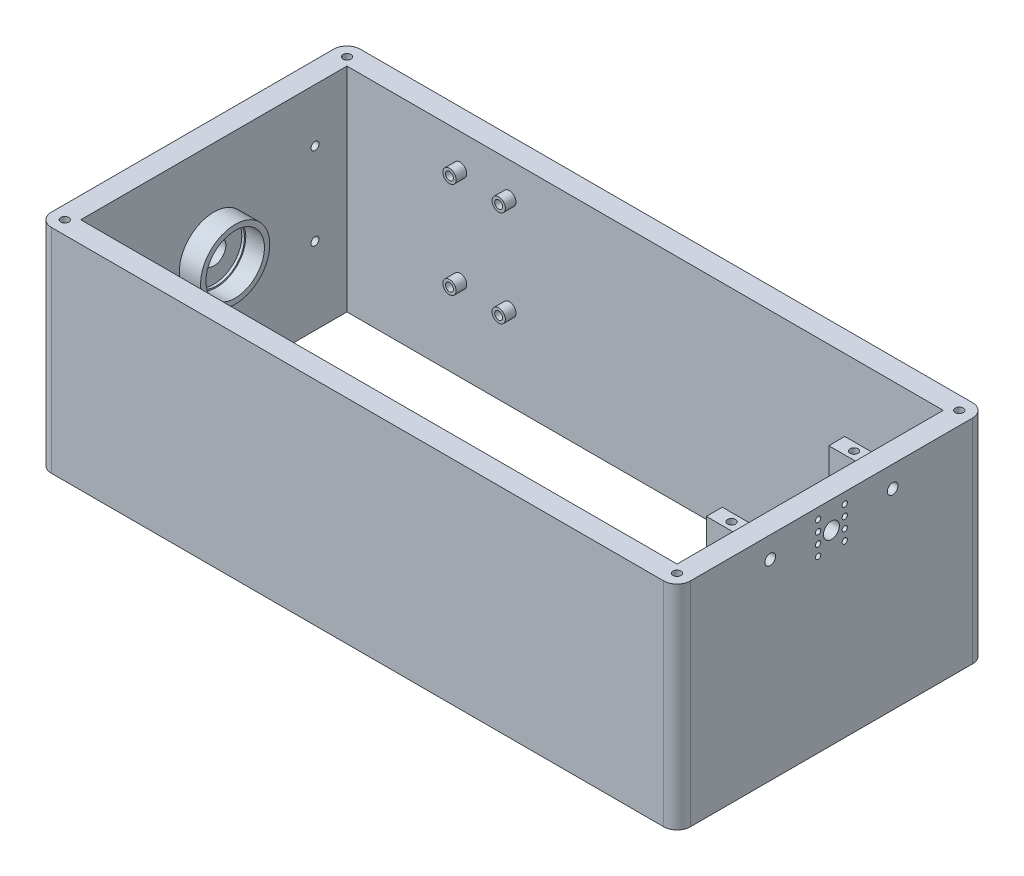
from build123d import *

# Parameters (mm, degrees)
SKETCH1_W           = 240
SKETCH1_H           = 116
BOSS_EXTRUDE1_DEPTH = 10
SKETCH10_W          = 240
SKETCH10_H          = 116
SKETCH10_W_2        = 224
SKETCH10_H_2        = 100
BOSS_EXTRUDE4_DEPTH = 80
CUT_EXTRUDE14_REACH = 257.515
SKETCH24_R          = 1.5
SKETCH14_R          = 13
SKETCH14_R_2        = 11
BOSS_EXTRUDE6_DEPTH = 8
SKETCH16_R          = 11
SKETCH16_R_2        = 10.5
BOSS_EXTRUDE7_DEPTH = 1
CUT_EXTRUDE9_REACH  = 257.515
SKETCH17_R          = 4.5
SKETCH18_R          = 2.5
SKETCH18_R_2        = 1.5
BOSS_EXTRUDE8_DEPTH = 4
FILLET1_R           = 5
CUT_EXTRUDE10_REACH = 162.823
SKETCH19_R          = 1.5
CUT_EXTRUDE11_REACH = 264.8
SKETCH20_R          = 2
SKETCH21_W          = 6
SKETCH21_H          = 10
SKETCH21_R          = 2
BOSS_EXTRUDE9_DEPTH = 13
CUT_EXTRUDE12_REACH = 161.163
SKETCH22_R          = 1.5
CUT_EXTRUDE13_REACH = 264.8
SKETCH23_R          = 1
SKETCH23_R_2        = 3
CUT_EXTRUDE15_REACH = 264.8
SKETCH32_W          = 116
SKETCH32_H          = 10


with BuildPart() as part:
    # Sketch1 → Boss-Extrude1 (new body)
    with BuildSketch(Plane(origin=(0, 0, 0), x_dir=(1, 0, 0), z_dir=(0, 1, 0))):
        Rectangle(SKETCH1_W, SKETCH1_H)
    extrude(amount=BOSS_EXTRUDE1_DEPTH)

    # Sketch10 → Boss-Extrude4 (add)
    with BuildSketch(Plane(origin=(0, 10, 0), x_dir=(1, 0, 0), z_dir=(0, 1, 0))):
        Rectangle(SKETCH10_W, SKETCH10_H)
        Rectangle(SKETCH10_W_2, SKETCH10_H_2, mode=Mode.SUBTRACT)
    extrude(amount=BOSS_EXTRUDE4_DEPTH)

    # Sketch24 → Cut-Extrude14 (cut, up to next)
    with BuildSketch(Plane(origin=(-112, 0, 0), x_dir=(0, 0, -1), z_dir=(1, 0, 0)), mode=Mode.PRIVATE) as cut_extrude14_sk1:
        with Locations((-38, 70)):
            Circle(SKETCH24_R)
    cut_extrude14_tool1 = extrude(cut_extrude14_sk1.sketch, amount=-CUT_EXTRUDE14_REACH, mode=Mode.PRIVATE) & part.part
    # Sketch24 → Cut-Extrude14 (cut, up to next)
    with BuildSketch(Plane(origin=(-112, 0, 0), x_dir=(0, 0, -1), z_dir=(1, 0, 0)), mode=Mode.PRIVATE) as cut_extrude14_sk2:
        with Locations((-38, 39)):
            Circle(SKETCH24_R)
    cut_extrude14_tool2 = extrude(cut_extrude14_sk2.sketch, amount=-CUT_EXTRUDE14_REACH, mode=Mode.PRIVATE) & part.part
    # Sketch24 → Cut-Extrude14 (cut, up to next)
    with BuildSketch(Plane(origin=(-112, 0, 0), x_dir=(0, 0, -1), z_dir=(1, 0, 0)), mode=Mode.PRIVATE) as cut_extrude14_sk3:
        with Locations((38, 39)):
            Circle(SKETCH24_R)
    cut_extrude14_tool3 = extrude(cut_extrude14_sk3.sketch, amount=-CUT_EXTRUDE14_REACH, mode=Mode.PRIVATE) & part.part
    # Sketch24 → Cut-Extrude14 (cut, up to next)
    with BuildSketch(Plane(origin=(-112, 0, 0), x_dir=(0, 0, -1), z_dir=(1, 0, 0)), mode=Mode.PRIVATE) as cut_extrude14_sk4:
        with Locations((38, 70)):
            Circle(SKETCH24_R)
    cut_extrude14_tool4 = extrude(cut_extrude14_sk4.sketch, amount=-CUT_EXTRUDE14_REACH, mode=Mode.PRIVATE) & part.part
    add(cut_extrude14_tool1.solids().sort_by_distance((-112, 70, 38))[0], mode=Mode.SUBTRACT)
    add(cut_extrude14_tool2.solids().sort_by_distance((-112, 39, 38))[0], mode=Mode.SUBTRACT)
    add(cut_extrude14_tool3.solids().sort_by_distance((-112, 39, -38))[0], mode=Mode.SUBTRACT)
    add(cut_extrude14_tool4.solids().sort_by_distance((-112, 70, -38))[0], mode=Mode.SUBTRACT)

    # Sketch14 → Boss-Extrude6 (add)
    with BuildSketch(Plane(origin=(-112, 0, 0), x_dir=(0, 0, -1), z_dir=(1, 0, 0))):
        with Locations((0, 54.5)):
            Circle(SKETCH14_R)
        with Locations((0, 54.5)):
            Circle(SKETCH14_R_2, mode=Mode.SUBTRACT)
    extrude(amount=BOSS_EXTRUDE6_DEPTH)

    # Sketch16 → Boss-Extrude7 (add)
    with BuildSketch(Plane(origin=(-112, 0, 0), x_dir=(0, 0, -1), z_dir=(1, 0, 0))):
        with Locations((0, 54.5)):
            Circle(SKETCH16_R)
        with Locations((0, 54.5)):
            Circle(SKETCH16_R_2, mode=Mode.SUBTRACT)
    extrude(amount=BOSS_EXTRUDE7_DEPTH)

    # Sketch17 → Cut-Extrude9 (cut, up to next)
    with BuildSketch(Plane(origin=(-112, 0, 0), x_dir=(0, 0, -1), z_dir=(1, 0, 0)), mode=Mode.PRIVATE) as cut_extrude9_sk1:
        with Locations((0, 54.5)):
            Circle(SKETCH17_R)
    cut_extrude9_tool1 = extrude(cut_extrude9_sk1.sketch, amount=-CUT_EXTRUDE9_REACH, mode=Mode.PRIVATE) & part.part
    add(cut_extrude9_tool1.solids().sort_by_distance((-112, 54.5, 0))[0], mode=Mode.SUBTRACT)

    # Sketch18 → Boss-Extrude8 (add)
    # profile 1 of 4: a face of its own
    with BuildSketch(Plane.XY.offset(-50)):
        with Locations((-69.5, 77.5)):
            Circle(SKETCH18_R)
        with Locations((-69.5, 77.5)):
            Circle(SKETCH18_R_2, mode=Mode.SUBTRACT)
    # profile 2 of 4: a face of its own
    with BuildSketch(Plane.XY.offset(-50)):
        with Locations(Location((-69.5, 41.351210886, 0), (0, 0, 180))):
            Circle(SKETCH18_R)
        with Locations(Location((-69.5, 41.351210886, 0), (0, 0, 180))):
            Circle(SKETCH18_R_2, mode=Mode.SUBTRACT)
    # profile 3 of 4: a face of its own
    with BuildSketch(Plane.XY.offset(-50)):
        with Locations((-51, 41.351210886)):
            Circle(SKETCH18_R)
        with Locations((-51, 41.351210886)):
            Circle(SKETCH18_R_2, mode=Mode.SUBTRACT)
    # profile 4 of 4: a face of its own
    with BuildSketch(Plane.XY.offset(-50)):
        with Locations(Location((-51, 77.5, 0), (0, 0, 180))):
            Circle(SKETCH18_R)
        with Locations(Location((-51, 77.5, 0), (0, 0, 180))):
            Circle(SKETCH18_R_2, mode=Mode.SUBTRACT)
    extrude(amount=BOSS_EXTRUDE8_DEPTH)

    # Fillet1
    fillet1_edges = [part.edges().sort_by_distance(p)[0] for p in [
        (0, 0, 58),
        (-120, 0, 0),
        (0, 0, -58),
        (120, 0, 0),
        (120, 45, 58),
        (-120, 45, 58),
        (-120, 45, -58),
        (120, 45, -58),
    ]]
    fillet(fillet1_edges, radius=FILLET1_R)

    # Sketch19 → Cut-Extrude10 (cut, up to next)
    with BuildSketch(Plane(origin=(0, 90, 0), x_dir=(1, 0, 0), z_dir=(0, 1, 0)), mode=Mode.PRIVATE) as cut_extrude10_sk1:
        with Locations(Location((115, 53, 0), (0, 0, 270))):
            Circle(SKETCH19_R)
    cut_extrude10_tool1 = extrude(cut_extrude10_sk1.sketch, amount=-CUT_EXTRUDE10_REACH, mode=Mode.PRIVATE) & part.part
    # Sketch19 → Cut-Extrude10 (cut, up to next)
    with BuildSketch(Plane(origin=(0, 90, 0), x_dir=(1, 0, 0), z_dir=(0, 1, 0)), mode=Mode.PRIVATE) as cut_extrude10_sk2:
        with Locations(Location((-115, 53, 0), (0, 0, 270))):
            Circle(SKETCH19_R)
    cut_extrude10_tool2 = extrude(cut_extrude10_sk2.sketch, amount=-CUT_EXTRUDE10_REACH, mode=Mode.PRIVATE) & part.part
    # Sketch19 → Cut-Extrude10 (cut, up to next)
    with BuildSketch(Plane(origin=(0, 90, 0), x_dir=(1, 0, 0), z_dir=(0, 1, 0)), mode=Mode.PRIVATE) as cut_extrude10_sk3:
        with Locations(Location((-115, -53, 0), (0, 0, 270))):
            Circle(SKETCH19_R)
    cut_extrude10_tool3 = extrude(cut_extrude10_sk3.sketch, amount=-CUT_EXTRUDE10_REACH, mode=Mode.PRIVATE) & part.part
    # Sketch19 → Cut-Extrude10 (cut, up to next)
    with BuildSketch(Plane(origin=(0, 90, 0), x_dir=(1, 0, 0), z_dir=(0, 1, 0)), mode=Mode.PRIVATE) as cut_extrude10_sk4:
        with Locations(Location((115, -53, 0), (0, 0, 270))):
            Circle(SKETCH19_R)
    cut_extrude10_tool4 = extrude(cut_extrude10_sk4.sketch, amount=-CUT_EXTRUDE10_REACH, mode=Mode.PRIVATE) & part.part
    add(cut_extrude10_tool1.solids().sort_by_distance((115, 90, -53))[0], mode=Mode.SUBTRACT)
    add(cut_extrude10_tool2.solids().sort_by_distance((-115, 90, -53))[0], mode=Mode.SUBTRACT)
    add(cut_extrude10_tool3.solids().sort_by_distance((-115, 90, 53))[0], mode=Mode.SUBTRACT)
    add(cut_extrude10_tool4.solids().sort_by_distance((115, 90, 53))[0], mode=Mode.SUBTRACT)

    # Sketch20 → Cut-Extrude11 (cut, up to next)
    with BuildSketch(Plane(origin=(120, 0, 0), x_dir=(0, 0, -1), z_dir=(1, 0, 0)), mode=Mode.PRIVATE) as cut_extrude11_sk1:
        with Locations((-23, 82)):
            Circle(SKETCH20_R)
    cut_extrude11_tool1 = extrude(cut_extrude11_sk1.sketch, amount=-CUT_EXTRUDE11_REACH, mode=Mode.PRIVATE) & part.part
    # Sketch20 → Cut-Extrude11 (cut, up to next)
    with BuildSketch(Plane(origin=(120, 0, 0), x_dir=(0, 0, -1), z_dir=(1, 0, 0)), mode=Mode.PRIVATE) as cut_extrude11_sk2:
        with Locations(Location((23, 82, 0), (0, 0, 180))):
            Circle(SKETCH20_R)
    cut_extrude11_tool2 = extrude(cut_extrude11_sk2.sketch, amount=-CUT_EXTRUDE11_REACH, mode=Mode.PRIVATE) & part.part
    add(cut_extrude11_tool1.solids().sort_by_distance((120, 82, 23))[0], mode=Mode.SUBTRACT)
    add(cut_extrude11_tool2.solids().sort_by_distance((120, 82, -23))[0], mode=Mode.SUBTRACT)

    # Sketch21 → Boss-Extrude9 (add)
    # profile 1 of 2: a face of its own
    with BuildSketch(Plane.ZY.offset(-112)):
        with Locations((-23, 82)):
            Rectangle(SKETCH21_W, SKETCH21_H)
        with Locations((-23, 82)):
            Circle(SKETCH21_R, mode=Mode.SUBTRACT)
    # profile 2 of 2: a face of its own
    with BuildSketch(Plane.ZY.offset(-112)):
        with Locations((23, 82)):
            Rectangle(SKETCH21_W, SKETCH21_H)
        with Locations(Location((23, 82, 0), (0, 0, 180))):
            Circle(SKETCH21_R, mode=Mode.SUBTRACT)
    extrude(amount=BOSS_EXTRUDE9_DEPTH)

    # Sketch22 → Cut-Extrude12 (cut, up to next)
    with BuildSketch(Plane(origin=(0, 87, 0), x_dir=(1, 0, 0), z_dir=(0, 1, 0)), mode=Mode.PRIVATE) as cut_extrude12_sk1:
        with Locations(Location((105.5, -23, 0), (0, 0, 270))):
            Circle(SKETCH22_R)
    cut_extrude12_tool1 = extrude(cut_extrude12_sk1.sketch, amount=-CUT_EXTRUDE12_REACH, mode=Mode.PRIVATE) & part.part
    # Sketch22 → Cut-Extrude12 (cut, up to next)
    with BuildSketch(Plane(origin=(0, 87, 0), x_dir=(1, 0, 0), z_dir=(0, 1, 0)), mode=Mode.PRIVATE) as cut_extrude12_sk2:
        with Locations(Location((105.5, 23, 0), (0, 0, 270))):
            Circle(SKETCH22_R)
    cut_extrude12_tool2 = extrude(cut_extrude12_sk2.sketch, amount=-CUT_EXTRUDE12_REACH, mode=Mode.PRIVATE) & part.part
    add(cut_extrude12_tool1.solids().sort_by_distance((105.5, 87, 23))[0], mode=Mode.SUBTRACT)
    add(cut_extrude12_tool2.solids().sort_by_distance((105.5, 87, -23))[0], mode=Mode.SUBTRACT)

    # Sketch23 → Cut-Extrude13 (cut, up to next)
    with BuildSketch(Plane(origin=(120, 0, 0), x_dir=(0, 0, -1), z_dir=(1, 0, 0)), mode=Mode.PRIVATE) as cut_extrude13_sk1:
        with Locations((5, 78)):
            Circle(SKETCH23_R)
    cut_extrude13_tool1 = extrude(cut_extrude13_sk1.sketch, amount=-CUT_EXTRUDE13_REACH, mode=Mode.PRIVATE) & part.part
    # Sketch23 → Cut-Extrude13 (cut, up to next)
    with BuildSketch(Plane(origin=(120, 0, 0), x_dir=(0, 0, -1), z_dir=(1, 0, 0)), mode=Mode.PRIVATE) as cut_extrude13_sk2:
        with Locations((-5, 78)):
            Circle(SKETCH23_R)
    cut_extrude13_tool2 = extrude(cut_extrude13_sk2.sketch, amount=-CUT_EXTRUDE13_REACH, mode=Mode.PRIVATE) & part.part
    # Sketch23 → Cut-Extrude13 (cut, up to next)
    with BuildSketch(Plane(origin=(120, 0, 0), x_dir=(0, 0, -1), z_dir=(1, 0, 0)), mode=Mode.PRIVATE) as cut_extrude13_sk3:
        with Locations((5, 74)):
            Circle(SKETCH23_R)
    cut_extrude13_tool3 = extrude(cut_extrude13_sk3.sketch, amount=-CUT_EXTRUDE13_REACH, mode=Mode.PRIVATE) & part.part
    # Sketch23 → Cut-Extrude13 (cut, up to next)
    with BuildSketch(Plane(origin=(120, 0, 0), x_dir=(0, 0, -1), z_dir=(1, 0, 0)), mode=Mode.PRIVATE) as cut_extrude13_sk4:
        with Locations((-5, 74)):
            Circle(SKETCH23_R)
    cut_extrude13_tool4 = extrude(cut_extrude13_sk4.sketch, amount=-CUT_EXTRUDE13_REACH, mode=Mode.PRIVATE) & part.part
    # Sketch23 → Cut-Extrude13 (cut, up to next)
    with BuildSketch(Plane(origin=(120, 0, 0), x_dir=(0, 0, -1), z_dir=(1, 0, 0)), mode=Mode.PRIVATE) as cut_extrude13_sk5:
        with Locations(Location((-5, 86, 0), (0, 0, 180))):
            Circle(SKETCH23_R)
    cut_extrude13_tool5 = extrude(cut_extrude13_sk5.sketch, amount=-CUT_EXTRUDE13_REACH, mode=Mode.PRIVATE) & part.part
    # Sketch23 → Cut-Extrude13 (cut, up to next)
    with BuildSketch(Plane(origin=(120, 0, 0), x_dir=(0, 0, -1), z_dir=(1, 0, 0)), mode=Mode.PRIVATE) as cut_extrude13_sk6:
        with Locations(Location((5, 86, 0), (0, 0, 180))):
            Circle(SKETCH23_R)
    cut_extrude13_tool6 = extrude(cut_extrude13_sk6.sketch, amount=-CUT_EXTRUDE13_REACH, mode=Mode.PRIVATE) & part.part
    # Sketch23 → Cut-Extrude13 (cut, up to next)
    with BuildSketch(Plane(origin=(120, 0, 0), x_dir=(0, 0, -1), z_dir=(1, 0, 0)), mode=Mode.PRIVATE) as cut_extrude13_sk7:
        with Locations(Location((-5, 82, 0), (0, 0, 180))):
            Circle(SKETCH23_R)
    cut_extrude13_tool7 = extrude(cut_extrude13_sk7.sketch, amount=-CUT_EXTRUDE13_REACH, mode=Mode.PRIVATE) & part.part
    # Sketch23 → Cut-Extrude13 (cut, up to next)
    with BuildSketch(Plane(origin=(120, 0, 0), x_dir=(0, 0, -1), z_dir=(1, 0, 0)), mode=Mode.PRIVATE) as cut_extrude13_sk8:
        with Locations(Location((5, 82, 0), (0, 0, 180))):
            Circle(SKETCH23_R)
    cut_extrude13_tool8 = extrude(cut_extrude13_sk8.sketch, amount=-CUT_EXTRUDE13_REACH, mode=Mode.PRIVATE) & part.part
    # Sketch23 → Cut-Extrude13 (cut, up to next)
    with BuildSketch(Plane(origin=(120, 0, 0), x_dir=(0, 0, -1), z_dir=(1, 0, 0)), mode=Mode.PRIVATE) as cut_extrude13_sk9:
        with Locations((0, 80)):
            Circle(SKETCH23_R_2)
    cut_extrude13_tool9 = extrude(cut_extrude13_sk9.sketch, amount=-CUT_EXTRUDE13_REACH, mode=Mode.PRIVATE) & part.part
    add(cut_extrude13_tool1.solids().sort_by_distance((120, 78, -5))[0], mode=Mode.SUBTRACT)
    add(cut_extrude13_tool2.solids().sort_by_distance((120, 78, 5))[0], mode=Mode.SUBTRACT)
    add(cut_extrude13_tool3.solids().sort_by_distance((120, 74, -5))[0], mode=Mode.SUBTRACT)
    add(cut_extrude13_tool4.solids().sort_by_distance((120, 74, 5))[0], mode=Mode.SUBTRACT)
    add(cut_extrude13_tool5.solids().sort_by_distance((120, 86, 5))[0], mode=Mode.SUBTRACT)
    add(cut_extrude13_tool6.solids().sort_by_distance((120, 86, -5))[0], mode=Mode.SUBTRACT)
    add(cut_extrude13_tool7.solids().sort_by_distance((120, 82, 5))[0], mode=Mode.SUBTRACT)
    add(cut_extrude13_tool8.solids().sort_by_distance((120, 82, -5))[0], mode=Mode.SUBTRACT)
    add(cut_extrude13_tool9.solids().sort_by_distance((120, 80, 0))[0], mode=Mode.SUBTRACT)

    # Sketch32 → Cut-Extrude15 (cut, up to next)
    with BuildSketch(Plane.ZY.offset(120), mode=Mode.PRIVATE) as cut_extrude15_sk1:
        with Locations((0, 5)):
            Rectangle(SKETCH32_W, SKETCH32_H)
    cut_extrude15_tool1 = extrude(cut_extrude15_sk1.sketch, amount=-CUT_EXTRUDE15_REACH, mode=Mode.PRIVATE) & part.part
    add(cut_extrude15_tool1.solids().sort_by_distance((-120, 5, 0))[0], mode=Mode.SUBTRACT)


solid = part.part
